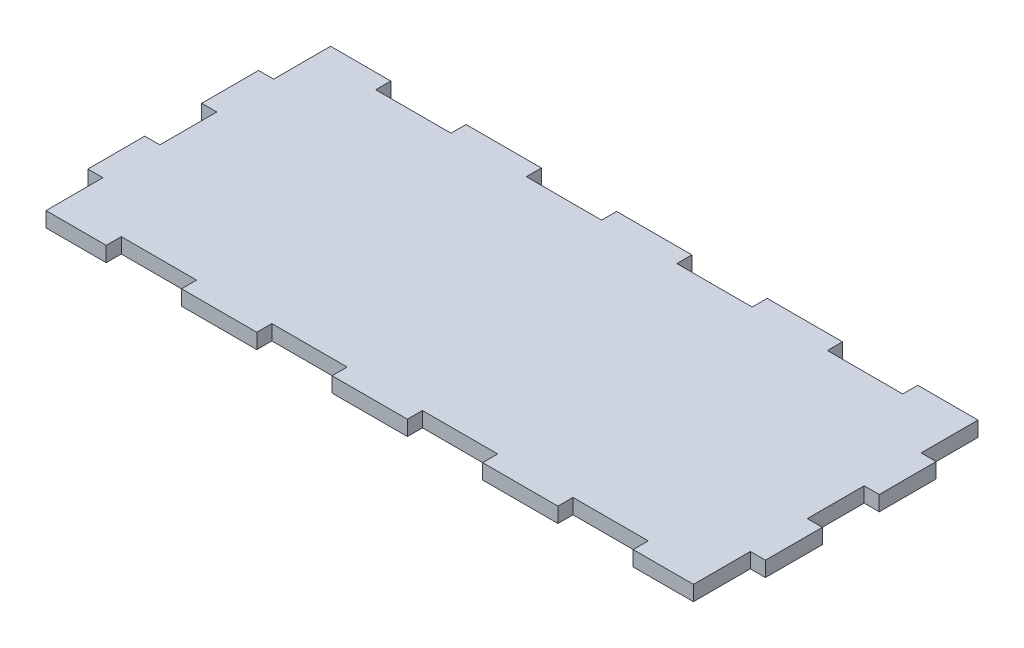
from build123d import *

# Parameters (mm, degrees)
SKETCH1_W           = 114.3
SKETCH1_H           = 48.006
BOSS_EXTRUDE1_DEPTH = 2.54
CUT_EXTRUDE2_REACH  = 64.038
SKETCH2_W           = 2.54
SKETCH2_H           = 9.6012
SKETCH2_W_2         = 12.7
SKETCH2_H_2         = 2.54


with BuildPart() as part:
    # Sketch1 → Boss-Extrude1 (new body)
    with BuildSketch(Plane(origin=(0, 0, 0), x_dir=(1, 0, 0), z_dir=(0, 1, 0))):
        Rectangle(SKETCH1_W, SKETCH1_H)
    extrude(amount=BOSS_EXTRUDE1_DEPTH)

    # Sketch2 → Cut-Extrude2 (cut, up to next)
    with BuildSketch(Plane(origin=(0, 2.54, 0), x_dir=(1, 0, 0), z_dir=(0, 1, 0)), mode=Mode.PRIVATE) as cut_extrude2_sk1:
        with Locations((-55.88, 19.2024)):
            Rectangle(SKETCH2_W, SKETCH2_H)
    cut_extrude2_tool1 = extrude(cut_extrude2_sk1.sketch, amount=-CUT_EXTRUDE2_REACH, mode=Mode.PRIVATE) & part.part
    # Sketch2 → Cut-Extrude2 (cut, up to next)
    with BuildSketch(Plane(origin=(0, 2.54, 0), x_dir=(1, 0, 0), z_dir=(0, 1, 0)), mode=Mode.PRIVATE) as cut_extrude2_sk2:
        with Locations((-38.1, 22.733)):
            Rectangle(SKETCH2_W_2, SKETCH2_H_2)
    cut_extrude2_tool2 = extrude(cut_extrude2_sk2.sketch, amount=-CUT_EXTRUDE2_REACH, mode=Mode.PRIVATE) & part.part
    # Sketch2 → Cut-Extrude2 (cut, up to next)
    with BuildSketch(Plane(origin=(0, 2.54, 0), x_dir=(1, 0, 0), z_dir=(0, 1, 0)), mode=Mode.PRIVATE) as cut_extrude2_sk3:
        with Locations((-12.7, 22.733)):
            Rectangle(SKETCH2_W_2, SKETCH2_H_2)
    cut_extrude2_tool3 = extrude(cut_extrude2_sk3.sketch, amount=-CUT_EXTRUDE2_REACH, mode=Mode.PRIVATE) & part.part
    # Sketch2 → Cut-Extrude2 (cut, up to next)
    with BuildSketch(Plane(origin=(0, 2.54, 0), x_dir=(1, 0, 0), z_dir=(0, 1, 0)), mode=Mode.PRIVATE) as cut_extrude2_sk4:
        with Locations((12.7, 22.733)):
            Rectangle(SKETCH2_W_2, SKETCH2_H_2)
    cut_extrude2_tool4 = extrude(cut_extrude2_sk4.sketch, amount=-CUT_EXTRUDE2_REACH, mode=Mode.PRIVATE) & part.part
    # Sketch2 → Cut-Extrude2 (cut, up to next)
    with BuildSketch(Plane(origin=(0, 2.54, 0), x_dir=(1, 0, 0), z_dir=(0, 1, 0)), mode=Mode.PRIVATE) as cut_extrude2_sk5:
        with Locations((38.1, 22.733)):
            Rectangle(SKETCH2_W_2, SKETCH2_H_2)
    cut_extrude2_tool5 = extrude(cut_extrude2_sk5.sketch, amount=-CUT_EXTRUDE2_REACH, mode=Mode.PRIVATE) & part.part
    # Sketch2 → Cut-Extrude2 (cut, up to next)
    with BuildSketch(Plane(origin=(0, 2.54, 0), x_dir=(1, 0, 0), z_dir=(0, 1, 0)), mode=Mode.PRIVATE) as cut_extrude2_sk6:
        with Locations((55.88, 19.2024)):
            Rectangle(SKETCH2_W, SKETCH2_H)
    cut_extrude2_tool6 = extrude(cut_extrude2_sk6.sketch, amount=-CUT_EXTRUDE2_REACH, mode=Mode.PRIVATE) & part.part
    # Sketch2 → Cut-Extrude2 (cut, up to next)
    with BuildSketch(Plane(origin=(0, 2.54, 0), x_dir=(1, 0, 0), z_dir=(0, 1, 0)), mode=Mode.PRIVATE) as cut_extrude2_sk7:
        with Locations((55.88, 0)):
            Rectangle(SKETCH2_W, SKETCH2_H)
    cut_extrude2_tool7 = extrude(cut_extrude2_sk7.sketch, amount=-CUT_EXTRUDE2_REACH, mode=Mode.PRIVATE) & part.part
    # Sketch2 → Cut-Extrude2 (cut, up to next)
    with BuildSketch(Plane(origin=(0, 2.54, 0), x_dir=(1, 0, 0), z_dir=(0, 1, 0)), mode=Mode.PRIVATE) as cut_extrude2_sk8:
        with Locations((55.88, -19.2024)):
            Rectangle(SKETCH2_W, SKETCH2_H)
    cut_extrude2_tool8 = extrude(cut_extrude2_sk8.sketch, amount=-CUT_EXTRUDE2_REACH, mode=Mode.PRIVATE) & part.part
    # Sketch2 → Cut-Extrude2 (cut, up to next)
    with BuildSketch(Plane(origin=(0, 2.54, 0), x_dir=(1, 0, 0), z_dir=(0, 1, 0)), mode=Mode.PRIVATE) as cut_extrude2_sk9:
        with Locations((38.1, -22.733)):
            Rectangle(SKETCH2_W_2, SKETCH2_H_2)
    cut_extrude2_tool9 = extrude(cut_extrude2_sk9.sketch, amount=-CUT_EXTRUDE2_REACH, mode=Mode.PRIVATE) & part.part
    # Sketch2 → Cut-Extrude2 (cut, up to next)
    with BuildSketch(Plane(origin=(0, 2.54, 0), x_dir=(1, 0, 0), z_dir=(0, 1, 0)), mode=Mode.PRIVATE) as cut_extrude2_sk10:
        with Locations((12.7, -22.733)):
            Rectangle(SKETCH2_W_2, SKETCH2_H_2)
    cut_extrude2_tool10 = extrude(cut_extrude2_sk10.sketch, amount=-CUT_EXTRUDE2_REACH, mode=Mode.PRIVATE) & part.part
    # Sketch2 → Cut-Extrude2 (cut, up to next)
    with BuildSketch(Plane(origin=(0, 2.54, 0), x_dir=(1, 0, 0), z_dir=(0, 1, 0)), mode=Mode.PRIVATE) as cut_extrude2_sk11:
        with Locations((-12.7, -22.733)):
            Rectangle(SKETCH2_W_2, SKETCH2_H_2)
    cut_extrude2_tool11 = extrude(cut_extrude2_sk11.sketch, amount=-CUT_EXTRUDE2_REACH, mode=Mode.PRIVATE) & part.part
    # Sketch2 → Cut-Extrude2 (cut, up to next)
    with BuildSketch(Plane(origin=(0, 2.54, 0), x_dir=(1, 0, 0), z_dir=(0, 1, 0)), mode=Mode.PRIVATE) as cut_extrude2_sk12:
        with Locations((-38.1, -22.733)):
            Rectangle(SKETCH2_W_2, SKETCH2_H_2)
    cut_extrude2_tool12 = extrude(cut_extrude2_sk12.sketch, amount=-CUT_EXTRUDE2_REACH, mode=Mode.PRIVATE) & part.part
    # Sketch2 → Cut-Extrude2 (cut, up to next)
    with BuildSketch(Plane(origin=(0, 2.54, 0), x_dir=(1, 0, 0), z_dir=(0, 1, 0)), mode=Mode.PRIVATE) as cut_extrude2_sk13:
        with Locations((-55.88, -19.2024)):
            Rectangle(SKETCH2_W, SKETCH2_H)
    cut_extrude2_tool13 = extrude(cut_extrude2_sk13.sketch, amount=-CUT_EXTRUDE2_REACH, mode=Mode.PRIVATE) & part.part
    # Sketch2 → Cut-Extrude2 (cut, up to next)
    with BuildSketch(Plane(origin=(0, 2.54, 0), x_dir=(1, 0, 0), z_dir=(0, 1, 0)), mode=Mode.PRIVATE) as cut_extrude2_sk14:
        with Locations((-55.88, 0)):
            Rectangle(SKETCH2_W, SKETCH2_H)
    cut_extrude2_tool14 = extrude(cut_extrude2_sk14.sketch, amount=-CUT_EXTRUDE2_REACH, mode=Mode.PRIVATE) & part.part
    add(cut_extrude2_tool1.solids().sort_by_distance((-55.88, 2.54, -19.2024))[0], mode=Mode.SUBTRACT)
    add(cut_extrude2_tool2.solids().sort_by_distance((-38.1, 2.54, -22.733))[0], mode=Mode.SUBTRACT)
    add(cut_extrude2_tool3.solids().sort_by_distance((-12.7, 2.54, -22.733))[0], mode=Mode.SUBTRACT)
    add(cut_extrude2_tool4.solids().sort_by_distance((12.7, 2.54, -22.733))[0], mode=Mode.SUBTRACT)
    add(cut_extrude2_tool5.solids().sort_by_distance((38.1, 2.54, -22.733))[0], mode=Mode.SUBTRACT)
    add(cut_extrude2_tool6.solids().sort_by_distance((55.88, 2.54, -19.2024))[0], mode=Mode.SUBTRACT)
    add(cut_extrude2_tool7.solids().sort_by_distance((55.88, 2.54, 0))[0], mode=Mode.SUBTRACT)
    add(cut_extrude2_tool8.solids().sort_by_distance((55.88, 2.54, 19.2024))[0], mode=Mode.SUBTRACT)
    add(cut_extrude2_tool9.solids().sort_by_distance((38.1, 2.54, 22.733))[0], mode=Mode.SUBTRACT)
    add(cut_extrude2_tool10.solids().sort_by_distance((12.7, 2.54, 22.733))[0], mode=Mode.SUBTRACT)
    add(cut_extrude2_tool11.solids().sort_by_distance((-12.7, 2.54, 22.733))[0], mode=Mode.SUBTRACT)
    add(cut_extrude2_tool12.solids().sort_by_distance((-38.1, 2.54, 22.733))[0], mode=Mode.SUBTRACT)
    add(cut_extrude2_tool13.solids().sort_by_distance((-55.88, 2.54, 19.2024))[0], mode=Mode.SUBTRACT)
    add(cut_extrude2_tool14.solids().sort_by_distance((-55.88, 2.54, 0))[0], mode=Mode.SUBTRACT)


solid = part.part
